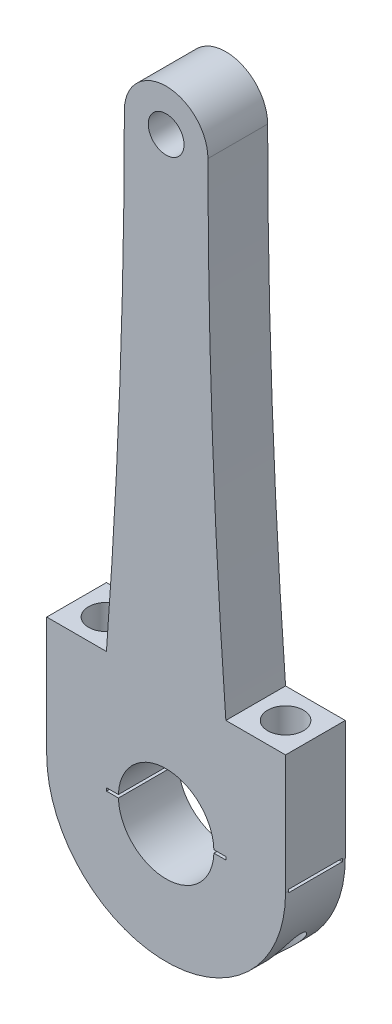
from build123d import *
from build123d.topology import SkipClean

# Parameters (mm, degrees)
SKETCH1_R                           = 4
BOSS_EXTRUDE1_DEPTH                 = 10
BOSS_EXTRUDE1_2_DEPTH               = 10
SKETCH2_R                           = 3
SKETCH2_R_2                         = 2.5
CUT_EXTRUDE1_DEPTH                  = 19.75
SKETCH2_2_R                         = 2.5
CUT_EXTRUDE2_DEPTH                  = 90.827612681
CUT_EXTRUDE3_REACH                  = 101.544
CUT_EXTRUDE3_END_RADIUS             = 4
SKETCH3_R                           = 1.25
CUT_EXTRUDE3_DIRECTION_2_REACH      = 101.544
CUT_EXTRUDE3_DIRECTION_2_END_RADIUS = 10
BOSS_EXTRUDE2_DEPTH                 = 0.5
BOSS_EXTRUDE3_START                 = -10
BOSS_EXTRUDE3_DEPTH                 = 0.5
BOSS_EXTRUDE4_DEPTH                 = 10
SKETCH8_R                           = 4
SKETCH8_R_2                         = 3
BOSS_EXTRUDE5_DEPTH                 = 10
CUT_EXTRUDE4_REACH                  = 91.828
SKETCH9_R                           = 1.25
CUT_EXTRUDE4_DIRECTION_2_REACH      = 91.828


with BuildPart() as part:
    # Sketch1 → Boss-Extrude1 (new body)
    with BuildSketch(Plane.XY):
        with BuildLine():
            Line((-20, 0.25), (-20, 20))
            Line((-20, 20), (-10, 20))
            ThreePointArc((-10, 20), (-7.750263487, 59.971884881), (-7, 100))
            ThreePointArc((-7, 100), (0, 107), (7, 100))
            ThreePointArc((7, 100), (7.750263487, 59.971884881), (10, 20))
            Line((10, 20), (20, 20))
            Line((20, 20), (20, 0.25))
            Line((20, 0.25), (9.996874512, 0.25))
            ThreePointArc((9.996874512, 0.25), (0, 10), (-9.996874512, 0.25))
            Line((-9.996874512, 0.25), (-20, 0.25))
        make_face()
        with Locations((0, 100)):
            Circle(SKETCH1_R, mode=Mode.SUBTRACT)
    extrude(amount=BOSS_EXTRUDE1_DEPTH)

    # Sketch2 → Cut-Extrude1 (cut)
    # profile 1 of 2: a face of its own
    with BuildSketch(Plane(origin=(0, 20, 0), x_dir=(1, 0, 0), z_dir=(0, 1, 0))):
        with Locations(Location((15, -5, 0), (0, 0, 270))):
            Circle(SKETCH2_R)
        with Locations(Location((15, -5, 0), (0, 0, 270))):
            Circle(SKETCH2_R_2, mode=Mode.SUBTRACT)
    # profile 2 of 2: a face of its own
    with BuildSketch(Plane(origin=(0, 20, 0), x_dir=(1, 0, 0), z_dir=(0, 1, 0))):
        with Locations(Location((-15, -5, 0), (0, 0, 270))):
            Circle(SKETCH2_R)
        with Locations(Location((-15, -5, 0), (0, 0, 270))):
            Circle(SKETCH2_R_2, mode=Mode.SUBTRACT)
    extrude(amount=-CUT_EXTRUDE1_DEPTH, mode=Mode.SUBTRACT)


with BuildPart() as body_2:
    # Sketch1 → Boss-Extrude1 2 (new body)
    with BuildSketch(Plane.XY):
        with BuildLine():
            Line((-19.998437439, -0.25), (-9.996874512, -0.25))
            ThreePointArc((-9.996874512, -0.25), (0, -10), (9.996874512, -0.25))
            Line((9.996874512, -0.25), (19.998437439, -0.25))
            ThreePointArc((19.998437439, -0.25), (0, -20), (-19.998437439, -0.25))
        make_face()
    extrude(amount=BOSS_EXTRUDE1_2_DEPTH)


with BuildPart() as cut_extrude1_piece_1:
    # of the separate pieces the step leaves, piece 1, a body of its own (cut_extrude1_pieces)
    add(part.part.solids().sort_by_distance((-9.996874512, 0.25, 0))[0])

    # Cut-Extrude3: up to this cylinder (the profile starts outside it)
    cut_extrude3_end = Plane(origin=(0, 100, 5), z_dir=(0, 0, -1)) * Cylinder(CUT_EXTRUDE3_END_RADIUS, 212.088, mode=Mode.PRIVATE)
    # Sketch3 → Cut-Extrude3 (cut, up to the surface)
    with BuildSketch(Plane(origin=(0, 10, 0), x_dir=(-1, 0, 0), z_dir=(0, -1, 0)), mode=Mode.PRIVATE) as cut_extrude3_sk1:
        with Locations(Location((0, -5, 0), (0, 0, 90))):
            Circle(SKETCH3_R)
    cut_extrude3_tool1 = extrude(cut_extrude3_sk1.sketch, amount=-CUT_EXTRUDE3_REACH, mode=Mode.PRIVATE) - cut_extrude3_end
    add(cut_extrude3_tool1.solids().sort_by_distance((0, 10, 5))[0], mode=Mode.SUBTRACT)

    # Cut-Extrude3 direction 2: up to this cylinder (the profile starts outside it)
    cut_extrude3_direction_2_end = Plane(origin=(0, 0, 5), z_dir=(0, 0, -1)) * Cylinder(CUT_EXTRUDE3_DIRECTION_2_END_RADIUS, 224.088, mode=Mode.PRIVATE)
    # Sketch3 → Cut-Extrude3 direction 2 (cut, up to the surface)
    with BuildSketch(Plane(origin=(0, 10, 0), x_dir=(-1, 0, 0), z_dir=(0, -1, 0)), mode=Mode.PRIVATE) as cut_extrude3_direction_2_sk1:
        with Locations(Location((0, -5, 0), (0, 0, 90))):
            Circle(SKETCH3_R)
    cut_extrude3_direction_2_tool1 = extrude(cut_extrude3_direction_2_sk1.sketch, amount=CUT_EXTRUDE3_DIRECTION_2_REACH, mode=Mode.PRIVATE) - cut_extrude3_direction_2_end
    add(cut_extrude3_direction_2_tool1.solids().sort_by_distance((0, 10, 5))[0], mode=Mode.SUBTRACT)
    add(cut_extrude3_direction_2_tool1.solids().sort_by_distance((0, 10, 5))[1], mode=Mode.SUBTRACT)

    # Sketch5 → Cut-Revolve1 (revolve, cut)
    with BuildSketch(Plane(origin=(0, 0, 0), x_dir=(0, 0, -1), z_dir=(1, 0, 0))):
        with BuildLine():
            Line((-5, 95.6), (-5.230940108, 96))
            Line((-5.230940108, 96), (-9, 96))
            ThreePointArc((-9, 96), (-8.882842712, 95.717157288), (-8.6, 95.6))
            Line((-8.6, 95.6), (-5, 95.6))
        make_face()
        with BuildLine():
            ThreePointArc((-1.4, 95.6), (-1.117157288, 95.717157288), (-1, 96))
            Line((-1, 96), (-4.769059892, 96))
            Line((-4.769059892, 96), (-5, 95.6))
            Line((-5, 95.6), (-1.4, 95.6))
        make_face()
    revolve(axis=Axis((0, 96, 10), (0, 0, -1)), mode=Mode.SUBTRACT)

    # Sketch5<5> → Cut-Revolve2 (revolve, cut)
    with BuildSketch(Plane(origin=(0, 0, 0), x_dir=(0, 0, -1), z_dir=(1, 0, 0)), mode=Mode.PRIVATE) as cut_revolve2_sk:
        Polygon((-5, 95.6), (-4.769059892, 96), (-5.230940108, 96), align=None)
    revolve(cut_revolve2_sk.sketch.rotate(Axis((0, 100, 10), (0, 0, -1)), 17.88577553), axis=Axis((0, 100, 10), (0, 0, -1)), mode=Mode.SUBTRACT)


with BuildPart() as cut_extrude1_piece_2:
    # of the separate pieces the step leaves, piece 2, a body of its own (cut_extrude1_pieces)
    add(part.part.solids().sort_by_distance((-15, 0.25, 7.5))[0])


with BuildPart() as cut_extrude1_piece_3:
    # of the separate pieces the step leaves, piece 3, a body of its own (cut_extrude1_pieces)
    add(part.part.solids().sort_by_distance((15, 0.25, 7.5))[0])


with BuildPart() as cut_extrude2_tool:
    # Sketch2<2> → Cut-Extrude2 (new, through all)
    with BuildSketch(Plane(origin=(0, 20, 0), x_dir=(1, 0, 0), z_dir=(0, 1, 0))):
        with Locations(Location((-15, -5, 0), (0, 0, 270))):
            Circle(SKETCH2_2_R)
        with Locations(Location((15, -5, 0), (0, 0, 270))):
            Circle(SKETCH2_2_R)
    extrude(amount=-CUT_EXTRUDE2_DEPTH)


with BuildPart() as body_2_1:
    add(body_2.part)

    # Cut-Extrude2: cut by cut_extrude2_tool
    add(cut_extrude2_tool.part, mode=Mode.SUBTRACT)


    add(cut_extrude1_piece_1.part)  # Boss-Extrude2 merges Cut-Extrude1 piece 1
    # Sketch6 → Boss-Extrude2 (add)
    with BuildSketch(Plane.XY.offset(10)):
        with BuildLine():
            Line((-20, 0.25), (-9.996874512, 0.25))
            ThreePointArc((-9.996874512, 0.25), (-10, 0), (-9.996874512, -0.25))
            Line((-9.996874512, -0.25), (-19.998437439, -0.25))
            ThreePointArc((-19.998437439, -0.25), (-19.999609356, -0.125002442), (-20, 0))
            Line((-20, 0), (-20, 0.25))
        make_face()
        with BuildLine():
            Line((9.996874512, -0.25), (19.998437439, -0.25))
            ThreePointArc((19.998437439, -0.25), (19.999609356, -0.125002442), (20, 0))
            Line((20, 0), (20, 0.25))
            Line((20, 0.25), (9.996874512, 0.25))
            ThreePointArc((9.996874512, 0.25), (10, 0), (9.996874512, -0.25))
        make_face()
    extrude(amount=-BOSS_EXTRUDE2_DEPTH)

    # Sketch6<2> → Boss-Extrude3 (add)
    with SkipClean():  # the faces are left unmerged after this step: merging them gives an invalid solid
        with BuildSketch(Plane.XY.offset(10).offset(BOSS_EXTRUDE3_START)):
            with BuildLine():
                Line((-20, 0.25), (-9.996874512, 0.25))
                ThreePointArc((-9.996874512, 0.25), (-10, 0), (-9.996874512, -0.25))
                Line((-9.996874512, -0.25), (-19.998437439, -0.25))
                ThreePointArc((-19.998437439, -0.25), (-19.999609356, -0.125002442), (-20, 0))
                Line((-20, 0), (-20, 0.25))
            make_face()
            with BuildLine():
                Line((9.996874512, -0.25), (19.998437439, -0.25))
                ThreePointArc((19.998437439, -0.25), (19.999609356, -0.125002442), (20, 0))
                Line((20, 0), (20, 0.25))
                Line((20, 0.25), (9.996874512, 0.25))
                ThreePointArc((9.996874512, 0.25), (10, 0), (9.996874512, -0.25))
            make_face()
        extrude(amount=BOSS_EXTRUDE3_DEPTH)

    # Sketch7 → Boss-Extrude4 (add)
    with SkipClean():  # the faces are left unmerged after this step: merging them gives an invalid solid
        with BuildSketch(Plane.XY.offset(10)):
            with BuildLine():
                Line((-7.996874512, 0.25), (-9.996874512, 0.25))
                ThreePointArc((-9.996874512, 0.25), (0, 10), (9.996874512, 0.25))
                Line((9.996874512, 0.25), (7.996874512, 0.25))
                ThreePointArc((7.996874512, 0.25), (0, 8.000781334), (-7.996874512, 0.25))
            make_face()
            with BuildLine():
                Line((-7.996874512, -0.25), (-9.996874512, -0.25))
                ThreePointArc((-9.996874512, -0.25), (0, -10), (9.996874512, -0.25))
                Line((9.996874512, -0.25), (7.996874512, -0.25))
                ThreePointArc((7.996874512, -0.25), (0, -8.000781334), (-7.996874512, -0.25))
            make_face()
        extrude(amount=-BOSS_EXTRUDE4_DEPTH)

    # Sketch8 → Boss-Extrude5 (add)
    with SkipClean():  # the faces are left unmerged after this step: merging them gives an invalid solid
        with BuildSketch(Plane.XY.offset(10)):
            with Locations(Location((0, 100, 0), (0, 0, 287.88577553))):
                Circle(SKETCH8_R)
            with Locations((0, 100)):
                Circle(SKETCH8_R_2, mode=Mode.SUBTRACT)
        extrude(amount=-BOSS_EXTRUDE5_DEPTH)

    # Sketch9 → Cut-Extrude4 (cut, up to next)
    with BuildSketch(Plane(origin=(0, 20, 0), x_dir=(1, 0, 0), z_dir=(0, 1, 0)), mode=Mode.PRIVATE) as cut_extrude4_sk1:
        with Locations(Location((0, -5, 0), (0, 0, 180))):
            Circle(SKETCH9_R)
    cut_extrude4_tool1 = extrude(cut_extrude4_sk1.sketch, amount=CUT_EXTRUDE4_REACH, mode=Mode.PRIVATE) & body_2_1.part
    add(cut_extrude4_tool1.solids().sort_by_distance((0, 20, 5))[0], mode=Mode.SUBTRACT)

    # Sketch9 → Cut-Extrude4 direction 2 (cut, up to next)
    with BuildSketch(Plane(origin=(0, 20, 0), x_dir=(1, 0, 0), z_dir=(0, 1, 0)), mode=Mode.PRIVATE) as cut_extrude4_direction_2_sk1:
        with Locations(Location((0, -5, 0), (0, 0, 180))):
            Circle(SKETCH9_R)
    cut_extrude4_direction_2_tool1 = extrude(cut_extrude4_direction_2_sk1.sketch, amount=-CUT_EXTRUDE4_DIRECTION_2_REACH, mode=Mode.PRIVATE) & body_2_1.part
    add(cut_extrude4_direction_2_tool1.solids().sort_by_distance((0, 20, 5))[0], mode=Mode.SUBTRACT)


with BuildPart() as cut_extrude1_piece_2_1:
    add(cut_extrude1_piece_2.part)

    # Cut-Extrude2: cut by cut_extrude2_tool
    add(cut_extrude2_tool.part, mode=Mode.SUBTRACT)


with BuildPart() as cut_extrude1_piece_3_1:
    add(cut_extrude1_piece_3.part)

    # Cut-Extrude2: cut by cut_extrude2_tool
    add(cut_extrude2_tool.part, mode=Mode.SUBTRACT)


solid = body_2_1.part
